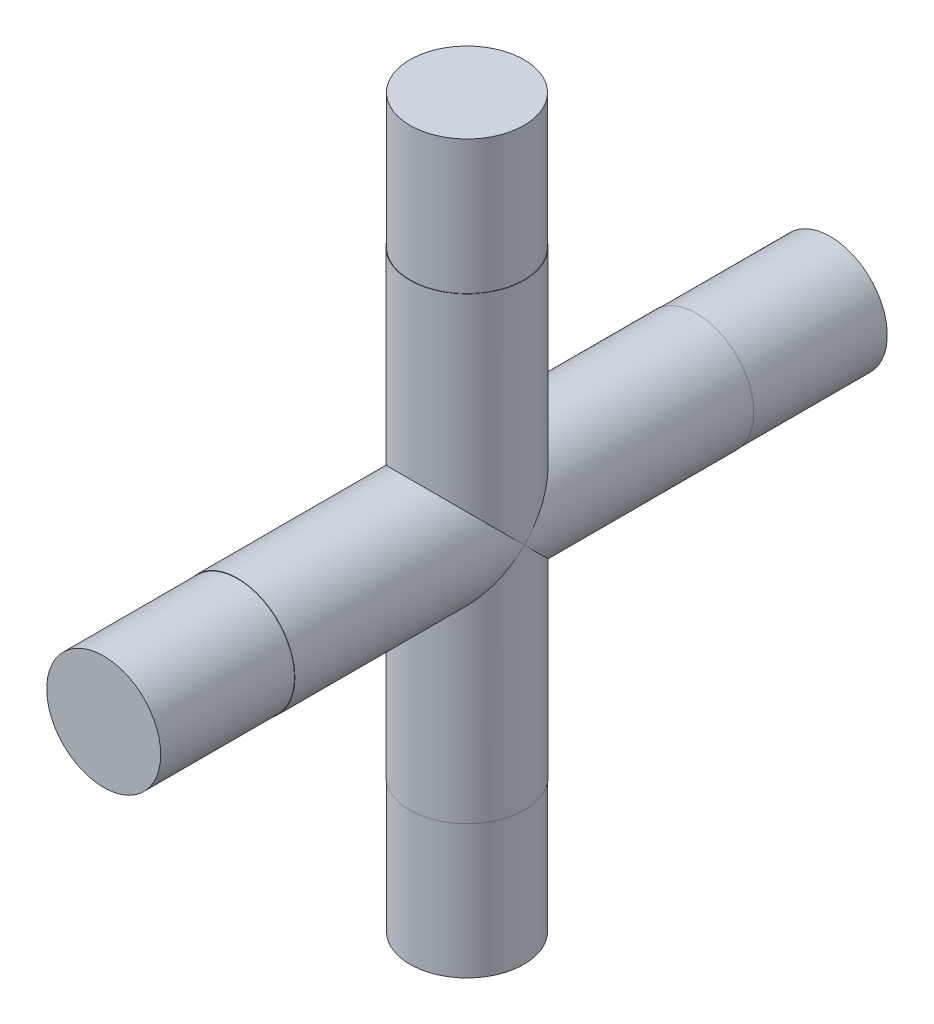
from build123d import *

# Parameters (mm, degrees)
SKETCH1_R                = 1.5
BOSS_EXTRUDE1_DEPTH      = 19
BOSS_EXTRUDE2_DEPTH      = 9.5
BOSS_EXTRUDE2_DEPTH_BACK = 9.5
SKETCH2_R                = 1.5
SKETCH3_R                = 1.5
SKETCH3_R_2              = 1.49
CUT_EXTRUDE1_DEPTH       = 3.5
CUT_EXTRUDE2_START       = -3.5
SKETCH4_R                = 1.5
SKETCH4_R_2              = 1.49
CUT_EXTRUDE2_DEPTH       = 3.5
CUT_EXTRUDE3_START       = -3.5
SKETCH5_R                = 1.5
SKETCH5_R_2              = 1.49
CUT_EXTRUDE3_DEPTH       = 3.5
SKETCH6_R                = 1.5
SKETCH6_R_2              = 1.49
CUT_EXTRUDE4_DEPTH       = 3.5


with BuildPart() as part:
    # Sketch1 → Boss-Extrude1 (new body)
    with BuildSketch(Plane(origin=(0, 0, 0), x_dir=(1, 0, 0), z_dir=(0, 1, 0))):
        Circle(SKETCH1_R)
    extrude(amount=BOSS_EXTRUDE1_DEPTH)

    # Sketch2 → Boss-Extrude2 (add, two sides: drawn at the far end of the back side and taken through both)
    with BuildSketch(Plane.XY.offset(-BOSS_EXTRUDE2_DEPTH_BACK)):
        with Locations((0, 9.5)):
            Circle(SKETCH2_R)
    extrude(amount=BOSS_EXTRUDE2_DEPTH + BOSS_EXTRUDE2_DEPTH_BACK)

    # Sketch3 → Cut-Extrude1 (cut)
    with BuildSketch(Plane(origin=(0, 0, -9.5), x_dir=(-1, 0, 0), z_dir=(0, 0, -1))):
        with Locations((0, 9.5)):
            Circle(SKETCH3_R)
        with Locations((0, 9.5)):
            Circle(SKETCH3_R_2, mode=Mode.SUBTRACT)
    extrude(amount=-CUT_EXTRUDE1_DEPTH, mode=Mode.SUBTRACT)

    # Sketch4 → Cut-Extrude2 (cut)
    with BuildSketch(Plane.XY.offset(9.5).offset(CUT_EXTRUDE2_START)):
        with Locations((0, 9.5)):
            Circle(SKETCH4_R)
        with Locations((0, 9.5)):
            Circle(SKETCH4_R_2, mode=Mode.SUBTRACT)
    extrude(amount=CUT_EXTRUDE2_DEPTH, mode=Mode.SUBTRACT)

    # Sketch5 → Cut-Extrude3 (cut)
    with BuildSketch(Plane(origin=(0, 19, 0), x_dir=(1, 0, 0), z_dir=(0, 1, 0)).offset(CUT_EXTRUDE3_START)):
        Circle(SKETCH5_R)
        Circle(SKETCH5_R_2, mode=Mode.SUBTRACT)
    extrude(amount=CUT_EXTRUDE3_DEPTH, mode=Mode.SUBTRACT)

    # Sketch6 → Cut-Extrude4 (cut)
    with BuildSketch(Plane.XZ):
        Circle(SKETCH6_R)
        Circle(SKETCH6_R_2, mode=Mode.SUBTRACT)
    extrude(amount=-CUT_EXTRUDE4_DEPTH, mode=Mode.SUBTRACT)


solid = part.part
